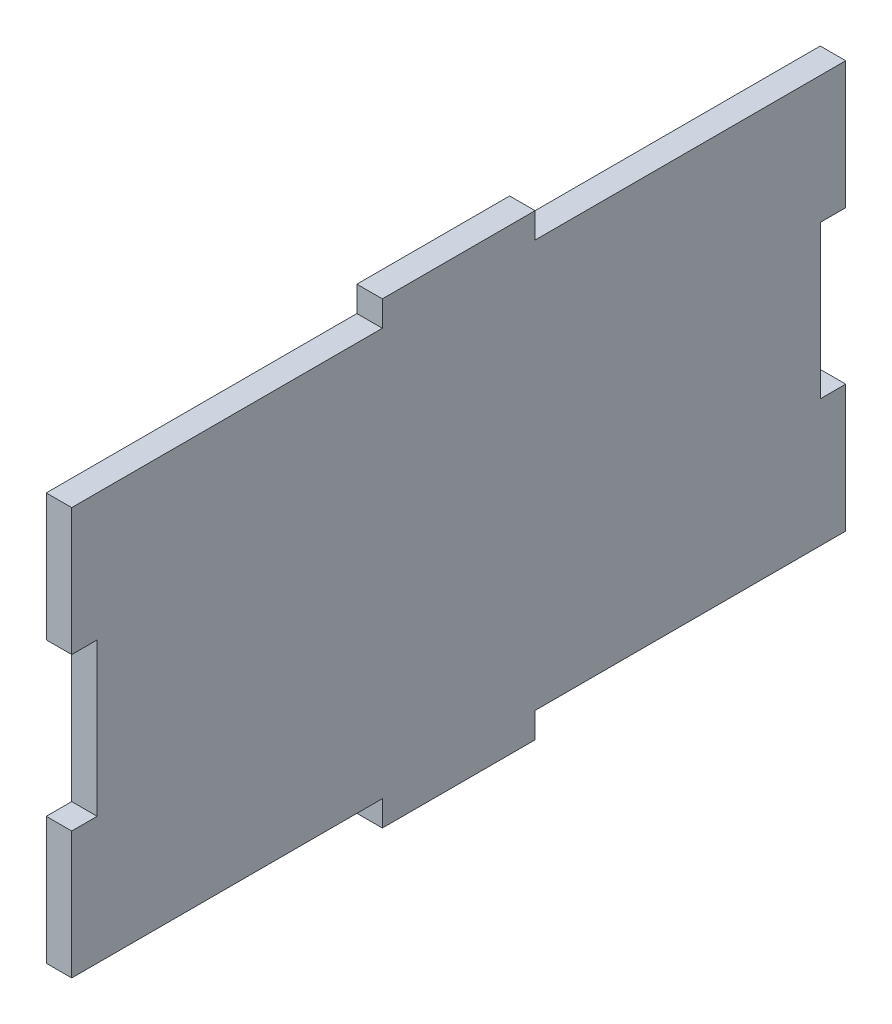
from build123d import *

# Parameters (mm, degrees)
BOSS_EXTRUDE1_DEPTH = 3.175


with BuildPart() as part:
    # Sketch1 → Boss-Extrude1 (new body)
    with BuildSketch(Plane(origin=(0, 0, 0), x_dir=(0, 0, -1), z_dir=(1, 0, 0))):
        Polygon((0, 0), (38.735, 0), (38.735, -3.175), (57.785, -3.175), (57.785, 0), (96.52, 0), (96.52, 15.875), (93.345, 15.875), (93.345, 34.925), (96.52, 34.925), (96.52, 50.8), (57.785, 50.8), (57.785, 53.975), (38.735, 53.975), (38.735, 50.8), (0, 50.8), (0, 34.925), (3.175, 34.925), (3.175, 15.875), (0, 15.875), align=None)
    extrude(amount=BOSS_EXTRUDE1_DEPTH)


solid = part.part
